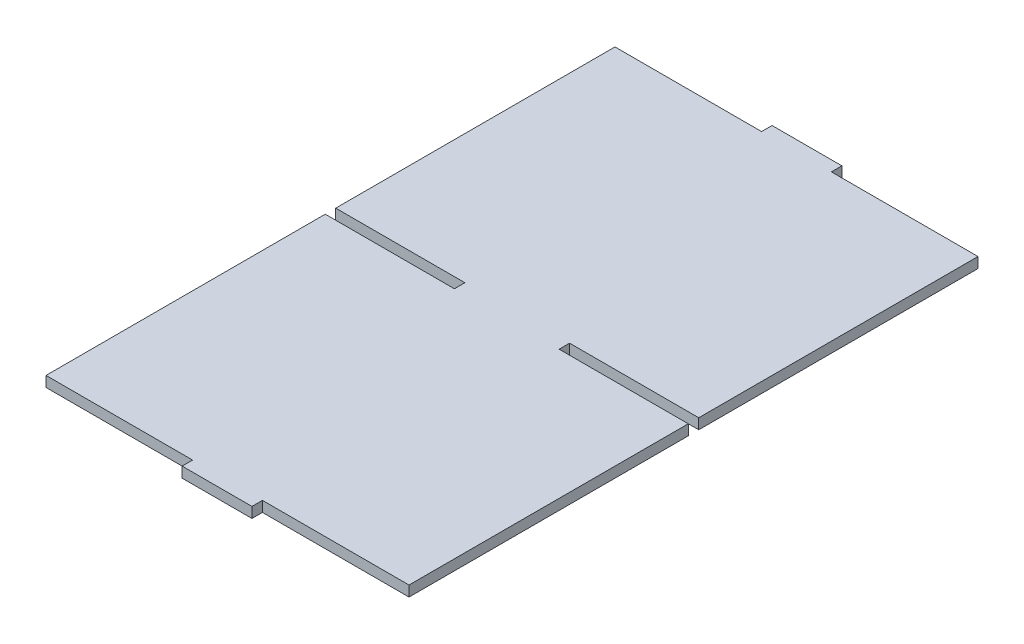
from build123d import *

# Parameters (mm, degrees)
BOSS_EXTRUDE1_DEPTH = 3


with BuildPart() as part:
    # Sketch1 → Boss-Extrude1 (new body)
    with BuildSketch(Plane(origin=(0, 0, 0), x_dir=(1, 0, 0), z_dir=(0, 1, 0))):
        Polygon((0, 0), (0, 3), (-42, 3), (-42, 83), (-5, 83), (-5, 86), (-42, 86), (-42, 166), (0, 166), (0, 169), (20, 169), (20, 166), (62, 166), (62, 86), (25, 86), (25, 83), (62, 83), (62, 3), (20, 3), (20, 0), align=None)
    extrude(amount=BOSS_EXTRUDE1_DEPTH)


solid = part.part
